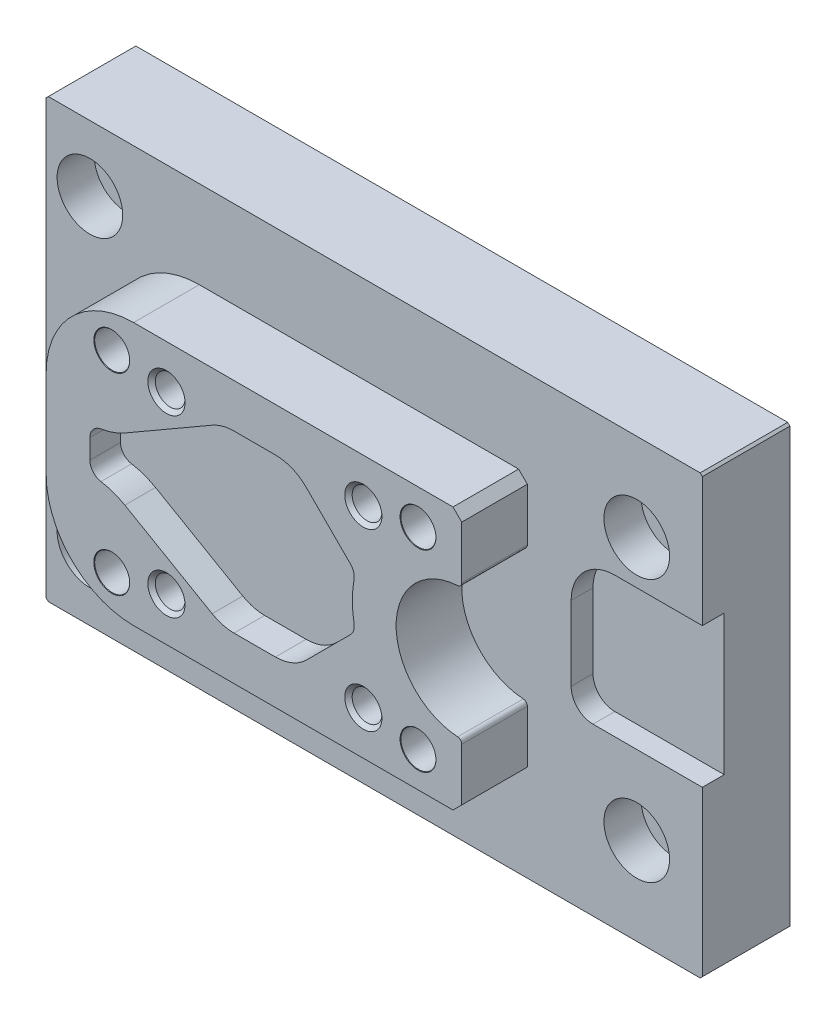
from build123d import *

# Parameters (mm, degrees)
SKETCH1_W                                    = 150
SKETCH1_H                                    = 100
EXTRUDE1_DEPTH                               = 20
EXTRUDE2_DEPTH                               = 15
FILLET1_R                                    = 20
CBORE_FOR_M8_HEX_SOCKET_HEAD_CAP_SCR_2_COUNT = 2
CBORE_FOR_M8_HEX_SOCKET_HEAD_CAP_SCR_2_PITCH = 125.099960032
M8_TAPPED_HOLE1_AT_2_COUNT                   = 2
M8_TAPPED_HOLE1_AT_2_PITCH                   = 45
F_8_0_8_DIAMETER_HOLE1_AT_2_COUNT            = 2
F_8_0_8_DIAMETER_HOLE1_AT_2_PITCH            = 70
EXTRUDE3_DEPTH                               = 7
FILLET2_R                                    = 3
FILLET3_R                                    = 10
CHAMFER1_SIZE                                = 0.5
CHAMFER2_SIZE                                = 2
FILLET4_R                                    = 1
SKETCH10_W                                   = 30
SKETCH10_H                                   = 32
EXTRUDE4_DEPTH                               = 5
FILLET5_R                                    = 10
FILLET6_R                                    = 5
SKETCH11_R                                   = 5
EXTRUDE5_DEPTH                               = 1


with BuildPart() as part:
    # Sketch1 → Extrude1 (new body)
    with BuildSketch(Plane.XY):
        with Locations((25, 0)):
            Rectangle(SKETCH1_W, SKETCH1_H)
    extrude(amount=EXTRUDE1_DEPTH)

    # Sketch2 → Extrude2 (add)
    with BuildSketch(Plane.XY.offset(20)):
        with BuildLine():
            Line((60, -15), (60, -30))
            Line((60, -30), (-35, -30))
            Line((-35, -30), (-35, 30))
            Line((-35, 30), (60, 30))
            Line((60, 30), (60, 15))
            ThreePointArc((60, 15), (45, 0), (60, -15))
        make_face()
    extrude(amount=EXTRUDE2_DEPTH)

    # Fillet1
    fillet1_edges = [part.edges().sort_by_distance(p)[0] for p in [
        (-35, 30, 27.5),
        (-35, -30, 27.5),
    ]]
    fillet(fillet1_edges, radius=FILLET1_R)

    # Sketch4 → CBORE for M8 Hex Socket Head Cap Screw1 (revolve, cut)
    with BuildSketch(Plane(origin=(-40, -35, 20), x_dir=(0, -1, 0), z_dir=(1, 0, 0))):
        Polygon((0, 0), (0, 20), (4.5, 20), (4.5, 8.525), (4.525, 8.5), (7.5, 8.5), (7.5, 0), align=None)
    cbore_for_m8_hex_socket_head_cap_screw1 = revolve(axis=Axis((-40, -35, 26.35), (0, 0, -1)), mode=Mode.SUBTRACT)

    # CBORE for M8 Hex Socket Head Cap Scr 2: CBORE for M8 Hex Socket Head Cap Screw1 ×2
    with Locations(*[Vector(0.9992009587217895, 0.03996803834887156, 0) * (i * CBORE_FOR_M8_HEX_SOCKET_HEAD_CAP_SCR_2_PITCH) for i in range(1, CBORE_FOR_M8_HEX_SOCKET_HEAD_CAP_SCR_2_COUNT)]):
        add(cbore_for_m8_hex_socket_head_cap_screw1, mode=Mode.SUBTRACT)

    # Sketch7 → M8 Tapped Hole1 (revolve, cut)
    with BuildSketch(Plane(origin=(-7.5, -20, 35), x_dir=(0, -1, 0), z_dir=(1, 0, 0))):
        Polygon((0, 0), (0, 24.292926105), (3.4, 22.25), (3.4, 0.85), (4.25, 0), align=None)
    m8_tapped_hole1 = revolve(axis=Axis((-7.5, -20, 41.35), (0, 0, -1)), mode=Mode.SUBTRACT)

    # M8 Tapped Hole1 at 2: M8 Tapped Hole1 ×2
    with Locations(*[(i * M8_TAPPED_HOLE1_AT_2_PITCH, 0, 0) for i in range(1, M8_TAPPED_HOLE1_AT_2_COUNT)]):
        add(m8_tapped_hole1, mode=Mode.SUBTRACT)

    # Sketch8 → Ø8.0 (8) Diameter Hole1 (revolve, cut)
    with BuildSketch(Plane(origin=(-20, -22, 35), x_dir=(0, -1, 0), z_dir=(1, 0, 0))):
        Polygon((0, 0), (0, 22.403442476), (4, 20), (4, 0.1), (4.1, 0), align=None)
    f_8_0_8_diameter_hole1 = revolve(axis=Axis((-20, -22, 41.35), (0, 0, -1)), mode=Mode.SUBTRACT)

    # Ø8.0 (8) Diameter Hole1 at 2: Ø8.0 (8) Diameter Hole1 ×2
    with Locations(*[(i * F_8_0_8_DIAMETER_HOLE1_AT_2_PITCH, 0, 0) for i in range(1, F_8_0_8_DIAMETER_HOLE1_AT_2_COUNT)]):
        add(f_8_0_8_diameter_hole1, mode=Mode.SUBTRACT)

    # Mirror1: CBORE for M8 Hex Socket Head Cap Screw1, M8 Tapped Hole1, Ø8.0 (8) Diameter Hole1 across plane
    add(cbore_for_m8_hex_socket_head_cap_screw1.mirror(Plane.ZX), mode=Mode.SUBTRACT)
    add(m8_tapped_hole1.mirror(Plane.ZX), mode=Mode.SUBTRACT)
    add(f_8_0_8_diameter_hole1.mirror(Plane.ZX), mode=Mode.SUBTRACT)

    # Mirror1 copy 1 sketch → Mirror1 copy 1 (revolve, cut)
    with BuildSketch(Plane(origin=(85, 30, 20), x_dir=(0, 1, 0), z_dir=(1, 0, 0))):
        Polygon((0, 0), (0, -20), (4.5, -20), (4.5, -8.525), (4.525, -8.5), (7.5, -8.5), (7.5, 0), align=None)
    revolve(axis=Axis((85, 30, 26.35), (0, 0, 1)), mode=Mode.SUBTRACT)

    # Mirror1 copy 2 sketch → Mirror1 copy 2 (revolve, cut)
    with BuildSketch(Plane(origin=(37.5, 20, 35), x_dir=(0, 1, 0), z_dir=(1, 0, 0))):
        Polygon((0, 0), (0, -24.292926105), (3.4, -22.25), (3.4, -0.85), (4.25, 0), align=None)
    revolve(axis=Axis((37.5, 20, 41.35), (0, 0, 1)), mode=Mode.SUBTRACT)

    # Mirror1 copy 3 sketch → Mirror1 copy 3 (revolve, cut)
    with BuildSketch(Plane(origin=(50, 22, 35), x_dir=(0, 1, 0), z_dir=(1, 0, 0))):
        Polygon((0, 0), (0, -22.403442476), (4, -20), (4, -0.1), (4.1, 0), align=None)
    revolve(axis=Axis((50, 22, 41.35), (0, 0, 1)), mode=Mode.SUBTRACT)

    # Sketch9 → Extrude3 (cut)
    with BuildSketch(Plane.XY.offset(35)):
        with BuildLine():
            Line((21.553843619, 20), (35.695979243, 5.857864376))
            ThreePointArc((35.695979243, 5.857864376), (35, 0), (35.695979243, -5.857864376))
            Line((35.695979243, -5.857864376), (21.553843619, -20))
            Line((21.553843619, -20), (5.267949192, -20))
            Line((5.267949192, -20), (-17, -7.143593539))
            ThreePointArc((-17, -7.143593539), (-20.858895278, -5.545186779), (-25, -5))
            Line((-25, -5), (-25, 5))
            ThreePointArc((-25, 5), (-20.858895278, 5.545186779), (-17, 7.143593539))
            Line((-17, 7.143593539), (5.267949192, 20))
            Line((5.267949192, 20), (21.553843619, 20))
        make_face()
    extrude(amount=-EXTRUDE3_DEPTH, mode=Mode.SUBTRACT)

    # Fillet2
    fillet2_edges = [part.edges().sort_by_distance(p)[0] for p in [
        (-25, -5, 31.5),
        (-25, 5, 31.5),
        (35.695979243, 5.857864376, 31.5),
        (35.695979243, -5.857864376, 31.5),
    ]]
    fillet(fillet2_edges, radius=FILLET2_R)

    # Fillet3
    fillet3_edges = [part.edges().sort_by_distance(p)[0] for p in [
        (5.267949192, 20, 31.5),
        (21.553843619, 20, 31.5),
        (21.553843619, -20, 31.5),
        (5.267949192, -20, 31.5),
    ]]
    fillet(fillet3_edges, radius=FILLET3_R)

    # Chamfer1
    chamfer1_edges = [part.edges().sort_by_distance(p)[0] for p in [
        (-50, 50, 10),
        (100, 50, 10),
        (100, -50, 10),
        (-50, -50, 10),
    ]]
    chamfer(chamfer1_edges, length=CHAMFER1_SIZE)

    # Chamfer2
    chamfer2_edges = [part.edges().sort_by_distance(p)[0] for p in [
        (60, -30, 27.5),
        (60, 30, 27.5),
    ]]
    chamfer(chamfer2_edges, length=CHAMFER2_SIZE)

    # Fillet4
    fillet4_edges = [part.edges().sort_by_distance(p)[0] for p in [
        (60, -15, 27.5),
        (60, 15, 27.5),
    ]]
    fillet(fillet4_edges, radius=FILLET4_R)

    # Sketch10 → Extrude4 (cut)
    with BuildSketch(Plane.XY.offset(20)):
        with Locations((85, 4)):
            Rectangle(SKETCH10_W, SKETCH10_H)
    extrude(amount=-EXTRUDE4_DEPTH, mode=Mode.SUBTRACT)

    # Fillet5
    fillet5_edges = [part.edges().sort_by_distance(p)[0] for p in [
        (70, 20, 17.5),
    ]]
    fillet(fillet5_edges, radius=FILLET5_R)

    # Fillet6
    fillet6_edges = [part.edges().sort_by_distance(p)[0] for p in [
        (70, -12, 17.5),
    ]]
    fillet(fillet6_edges, radius=FILLET6_R)

    # Sketch11 → Extrude5 (cut)
    with BuildSketch(Plane(origin=(0, 0, 0), x_dir=(-1, 0, 0), z_dir=(0, 0, -1))):
        with Locations((40, -35)):
            Circle(SKETCH11_R)
        with Locations((-85, -30)):
            Circle(SKETCH11_R)
        with Locations((-85, 30)):
            Circle(SKETCH11_R)
        with Locations((40, 35)):
            Circle(SKETCH11_R)
    extrude(amount=-EXTRUDE5_DEPTH, mode=Mode.SUBTRACT)


solid = part.part
